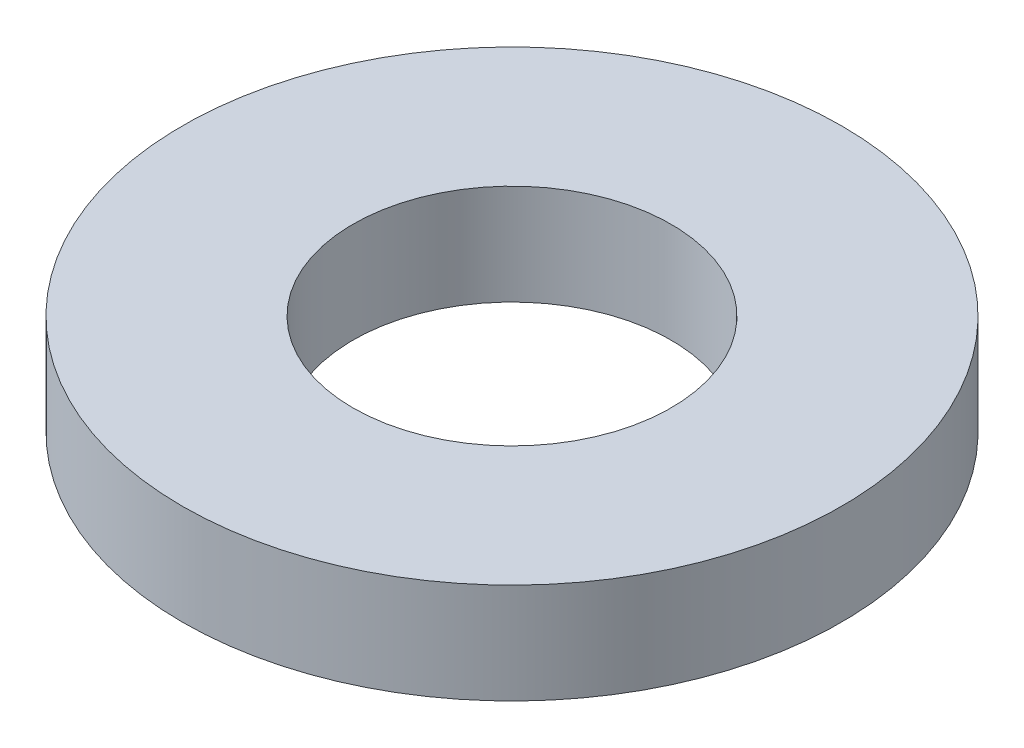
from build123d import *

# Parameters (mm, degrees)
ESQUISSE1_W = 4.5
ESQUISSE1_H = 2.65


with BuildPart() as part:
    # Esquisse1 → Révolution1 (revolve)
    with BuildSketch(Plane(origin=(0, 0, 10.400028379), x_dir=(-1, 0, 0), z_dir=(0, 0, -1)), mode=Mode.PRIVATE) as r_volution1_sk:
        with Locations((-43.3077939, -20.31214263)):
            Rectangle(ESQUISSE1_W, ESQUISSE1_H)
    revolve(r_volution1_sk.sketch.rotate(Axis((36.8577939, -21.63714263, 10.400028379), (0, 1, 0)), 270), axis=Axis((36.8577939, -21.63714263, 10.400028379), (0, 1, 0)))


solid = part.part
